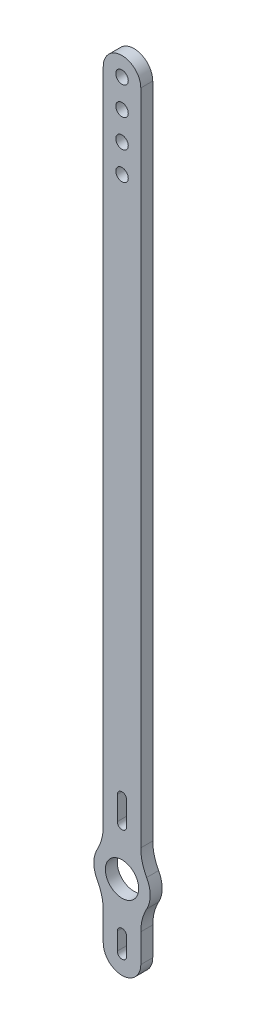
from build123d import *

# Parameters (mm, degrees)
MODEL_R             = 3.55
MODEL_R_2           = 1.33
BOSS_EXTRUDE1_DEPTH = 2.55


with BuildPart() as part:
    # Model → Boss-Extrude1 (new body)
    with BuildSketch(Plane.XY):
        with BuildLine():
            Line((-4, 148), (-4, 7.745966692))
            ThreePointArc((-4, 7.745966692), (-4.317541634, 5.245966692), (-5.25, 2.90473751))
            ThreePointArc((-5.25, 2.90473751), (-6, 0), (-5.25, -2.90473751))
            ThreePointArc((-5.25, -2.90473751), (-4.317541634, -5.245966692), (-4, -7.745966692))
            Line((-4, -7.745966692), (-4, -13.8))
            ThreePointArc((-4, -13.8), (0, -17.8), (4, -13.8))
            Line((4, -13.8), (4, -7.745966692))
            ThreePointArc((4, -7.745966692), (4.317541634, -5.245966692), (5.25, -2.90473751))
            ThreePointArc((5.25, -2.90473751), (6, 0), (5.25, 2.90473751))
            ThreePointArc((5.25, 2.90473751), (4.317541634, 5.245966692), (4, 7.745966692))
            Line((4, 7.745966692), (4, 148))
            ThreePointArc((4, 148), (0, 152), (-4, 148))
        make_face()
        Circle(MODEL_R, mode=Mode.SUBTRACT)
        with Locations((0, 148)):
            Circle(MODEL_R_2, mode=Mode.SUBTRACT)
        with Locations((0, 142)):
            Circle(MODEL_R_2, mode=Mode.SUBTRACT)
        with Locations((0, 136)):
            Circle(MODEL_R_2, mode=Mode.SUBTRACT)
        with Locations((0, 130)):
            Circle(MODEL_R_2, mode=Mode.SUBTRACT)
        with BuildLine():
            Line((-1, -10.1), (-1, -13.8))
            ThreePointArc((-1, -13.8), (0, -14.8), (1, -13.8))
            Line((1, -13.8), (1, -10.1))
            ThreePointArc((1, -10.1), (0, -9.1), (-1, -10.1))
        make_face(mode=Mode.SUBTRACT)
        with BuildLine():
            Line((-1, 15.1), (-1, 10.1))
            ThreePointArc((-1, 10.1), (0, 9.1), (1, 10.1))
            Line((1, 10.1), (1, 15.1))
            ThreePointArc((1, 15.1), (0, 16.1), (-1, 15.1))
        make_face(mode=Mode.SUBTRACT)
    extrude(amount=BOSS_EXTRUDE1_DEPTH)


solid = part.part
